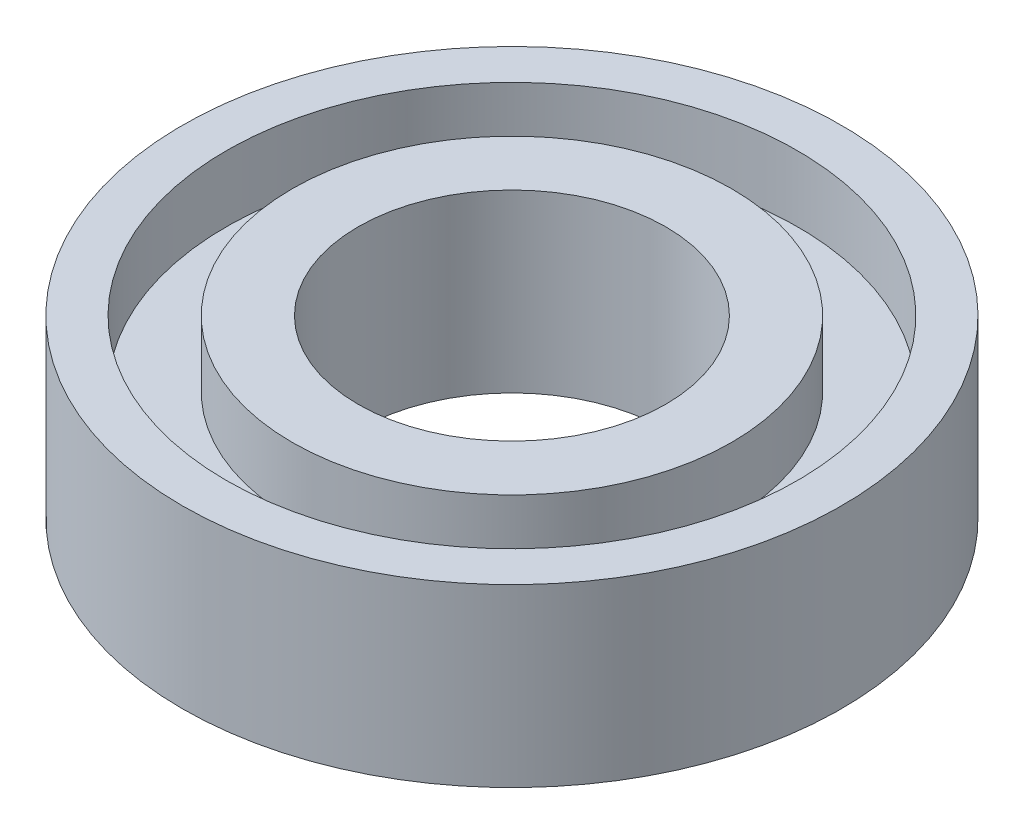
from build123d import *

# Parameters (mm, degrees)
SKETCH2_R           = 15
SKETCH2_R_2         = 7
BOSS_EXTRUDE1_DEPTH = 8
SKETCH3_R           = 13
SKETCH3_R_2         = 10
CUT_EXTRUDE1_DEPTH  = 3


with BuildPart() as part:
    # Sketch2 → Boss-Extrude1 (new body)
    with BuildSketch(Plane(origin=(0, 0, 0), x_dir=(1, 0, 0), z_dir=(0, 1, 0))):
        with Locations(Location((0, 0, 0), (0, 0, 270))):
            Circle(SKETCH2_R)
        with Locations(Location((0, 0, 0), (0, 0, 270))):
            Circle(SKETCH2_R_2, mode=Mode.SUBTRACT)
    extrude(amount=BOSS_EXTRUDE1_DEPTH)

    # Sketch3 → Cut-Extrude1 (cut)
    with BuildSketch(Plane(origin=(0, 8, 0), x_dir=(1, 0, 0), z_dir=(0, 1, 0))):
        with Locations(Location((0, 0, 0), (0, 0, 270))):
            Circle(SKETCH3_R)
        with Locations(Location((0, 0, 0), (0, 0, 270))):
            Circle(SKETCH3_R_2, mode=Mode.SUBTRACT)
    extrude(amount=-CUT_EXTRUDE1_DEPTH, mode=Mode.SUBTRACT)


solid = part.part
